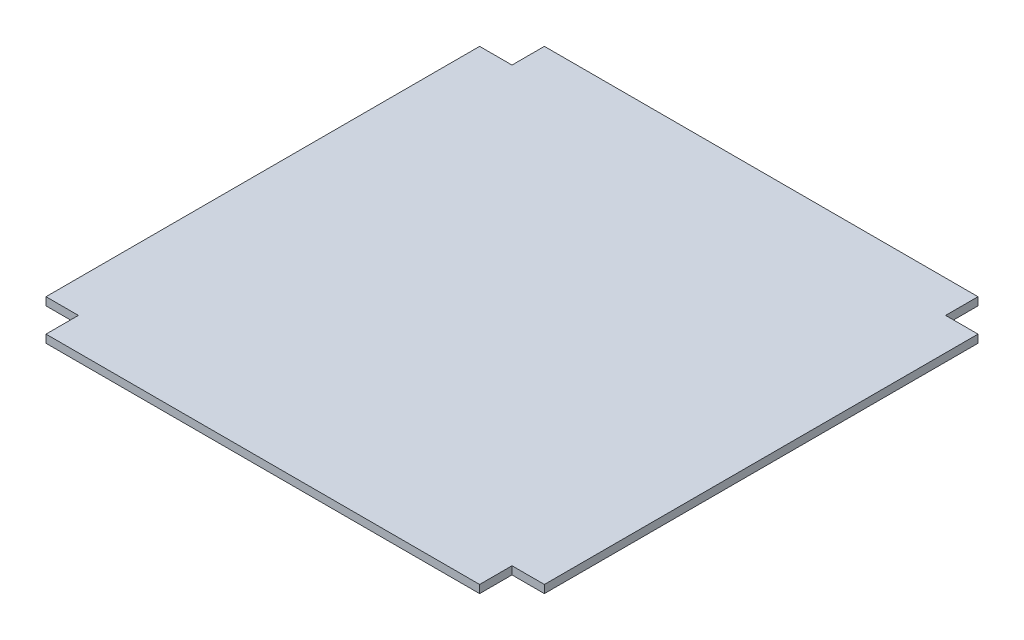
from build123d import *

# Parameters (mm, degrees)
BOSS_EXTRUDE1_DEPTH = 1.6


with BuildPart() as part:
    # Sketch1 → Boss-Extrude1 (new body)
    with BuildSketch(Plane(origin=(0, 0, 0), x_dir=(1, 0, 0), z_dir=(0, 1, 0))):
        Polygon((43.5, 50), (-43.5, 50), (-43.5, 43.5), (-50, 43.5), (-50, -43.5), (-43.5, -43.5), (-43.5, -50), (43.5, -50), (43.5, -43.5), (50, -43.5), (50, 43.5), (43.5, 43.5), align=None)
    extrude(amount=BOSS_EXTRUDE1_DEPTH)


solid = part.part
